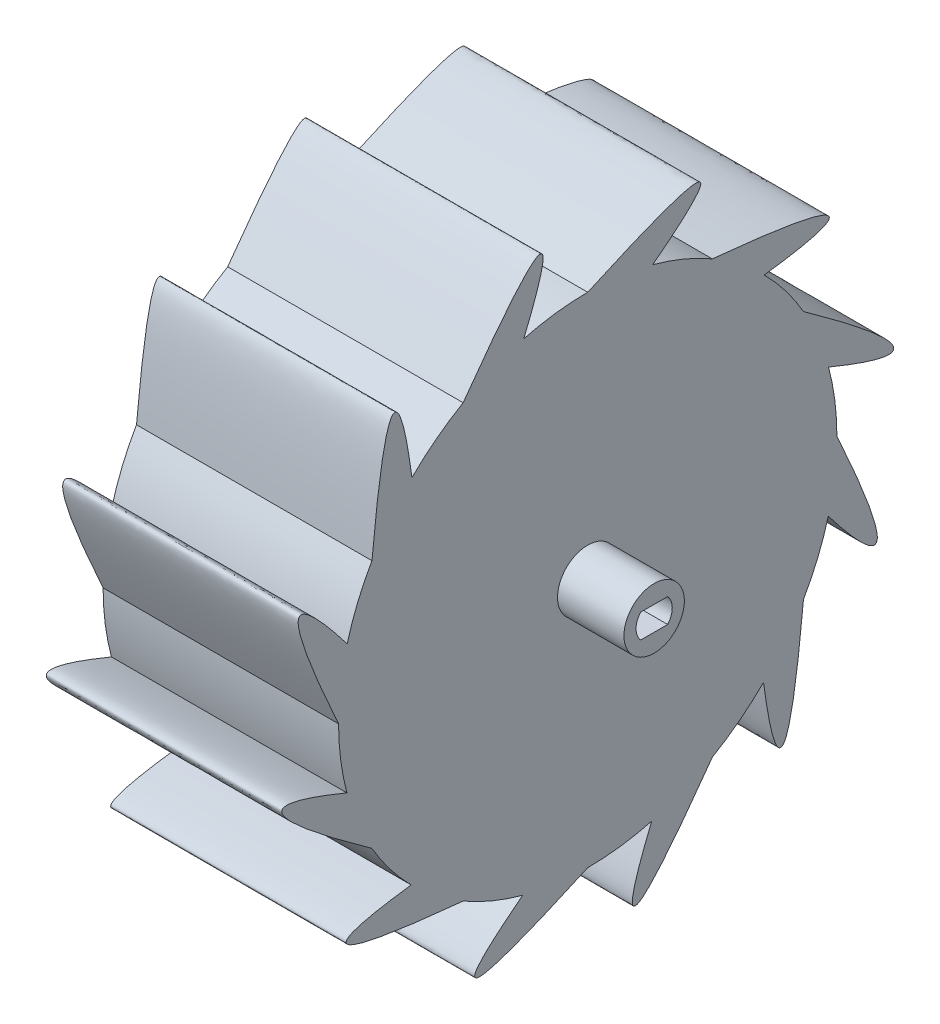
from build123d import *

# Parameters (mm, degrees)
SKETCH1_R           = 32.5
SKETCH1_R_2         = 5
BOSS_EXTRUDE1_DEPTH = 35
SKETCH2_R           = 8.5
SKETCH2_R_2         = 1
BOSS_EXTRUDE2_DEPTH = 1
SKETCH3_R           = 32.5
BOSS_EXTRUDE4_DEPTH = 2
SKETCH4_R           = 32.5
SKETCH4_R_2         = 5
BOSS_EXTRUDE5_DEPTH = 2
SKETCH5_R           = 5
BOSS_EXTRUDE6_DEPTH = 48
BOSS_EXTRUDE7_START = -39
SKETCH6_R           = 32.5
BOSS_EXTRUDE7_DEPTH = 39


with BuildPart() as part:
    # Sketch1 → Boss-Extrude1 (new body)
    with BuildSketch(Plane(origin=(0, 0, 0), x_dir=(0, 0, -1), z_dir=(1, 0, 0))):
        Circle(SKETCH1_R)
        Circle(SKETCH1_R_2, mode=Mode.SUBTRACT)
    extrude(amount=-BOSS_EXTRUDE1_DEPTH)



with BuildPart() as body_2:
    # Sketch2 → Boss-Extrude2 (new body)
    with BuildSketch(Plane.ZY.offset(35)):
        Circle(SKETCH2_R)
        Circle(SKETCH2_R_2, mode=Mode.SUBTRACT)
    extrude(amount=-BOSS_EXTRUDE2_DEPTH)


with BuildPart() as part_1:
    add(part.part)

    add(body_2.part)  # Boss-Extrude4 merges body 2
    # Sketch3 → Boss-Extrude4 (add)
    with BuildSketch(Plane.ZY.offset(35)):
        with Locations(Location((0, 0, 0), (0, 0, 180))):
            Circle(SKETCH3_R)
        with BuildLine():
            Line((12.893796958, 4), (20.615528128, 4))
            ThreePointArc((20.615528128, 4), (21, 0), (20.615528128, -4))
            Line((20.615528128, -4), (12.893796958, -4))
            ThreePointArc((12.893796958, -4), (13.5, 0), (12.893796958, 4))
        make_face(mode=Mode.SUBTRACT)
        with BuildLine():
            Line((7.788628447, -11.026661639), (10.174774605, -18.370464386))
            ThreePointArc((10.174774605, -18.370464386), (6.489356882, -19.972186842), (2.566322474, -20.842600341))
            Line((2.566322474, -20.842600341), (0.180176317, -13.498797594))
            ThreePointArc((0.180176317, -13.498797594), (4.171729424, -12.83926297), (7.788628447, -11.026661639))
        make_face(mode=Mode.SUBTRACT)
        with BuildLine():
            Line((-8.080159852, -10.814851676), (-14.327171594, -15.353571379))
            ThreePointArc((-14.327171594, -15.353571379), (-16.989356882, -12.343490298), (-19.029453613, -8.881435424))
            Line((-19.029453613, -8.881435424), (-12.78244187, -4.342715721))
            ThreePointArc((-12.78244187, -4.342715721), (-10.921729424, -7.935100906), (-8.080159852, -10.814851676))
        make_face(mode=Mode.SUBTRACT)
        with BuildLine():
            Line((-12.78244187, 4.342715721), (-19.029453613, 8.881435424))
            ThreePointArc((-19.029453613, 8.881435424), (-16.989356882, 12.343490298), (-14.327171594, 15.353571379))
            Line((-14.327171594, 15.353571379), (-8.080159852, 10.814851676))
            ThreePointArc((-8.080159852, 10.814851676), (-10.921729424, 7.935100906), (-12.78244187, 4.342715721))
        make_face(mode=Mode.SUBTRACT)
        with BuildLine():
            Line((0.180176317, 13.498797594), (2.566322474, 20.842600341))
            ThreePointArc((2.566322474, 20.842600341), (6.489356882, 19.972186842), (10.174774605, 18.370464386))
            Line((10.174774605, 18.370464386), (7.788628447, 11.026661639))
            ThreePointArc((7.788628447, 11.026661639), (4.171729424, 12.83926297), (0.180176317, 13.498797594))
        make_face(mode=Mode.SUBTRACT)
        with BuildLine():
            Line((-2.236067977, 2), (2.236067977, 2))
            ThreePointArc((2.236067977, 2), (3, 0), (2.236067977, -2))
            Line((2.236067977, -2), (-2.236067977, -2))
            ThreePointArc((-2.236067977, -2), (-3, 0), (-2.236067977, 2))
        make_face(mode=Mode.SUBTRACT)
    extrude(amount=BOSS_EXTRUDE4_DEPTH)

    # Sketch4 → Boss-Extrude5 (add)
    with BuildSketch(Plane.ZY.offset(37)):
        with Locations(Location((0, 0, 0), (0, 0, 180))):
            Circle(SKETCH4_R)
        with Locations(Location((0, 0, 0), (0, 0, 180))):
            Circle(SKETCH4_R_2, mode=Mode.SUBTRACT)
    extrude(amount=BOSS_EXTRUDE5_DEPTH)



with BuildPart() as body_2_2:
    # Sketch5 → Boss-Extrude6 (new body)
    with BuildSketch(Plane.ZY.offset(37)):
        with Locations(Location((0, 0, 0), (0, 0, 180))):
            Circle(SKETCH5_R)
        with BuildLine():
            Line((2.236067977, 2), (-2.236067977, 2))
            ThreePointArc((-2.236067977, 2), (-3, 0), (-2.236067977, -2))
            Line((-2.236067977, -2), (2.236067977, -2))
            ThreePointArc((2.236067977, -2), (3, 0), (2.236067977, 2))
        make_face(mode=Mode.SUBTRACT)
    extrude(amount=-BOSS_EXTRUDE6_DEPTH)


with BuildPart() as part_2:
    add(part_1.part)

    add(body_2_2.part)  # Boss-Extrude7 merges body 2 2
    # Sketch6 → Boss-Extrude7 (add)
    with BuildSketch(Plane.ZY.offset(39).offset(BOSS_EXTRUDE7_START)):
        with BuildLine():
            ThreePointArc((-29.245375884, 29.119081191), (-32.76885557, 25.088144702), (-35.740868414, 20.635))
            add(Edge.make_bspline(
                [(-35.740868414, 20.635), (-63.383686698, 0.881779004), (-39.886779054, 10.595176105)],
                knots=[0, 0, 0, 1, 1, 1], degree=2))
            ThreePointArc((-39.886779054, 10.595176105), (-40.922733728, 5.342542861), (-41.27, 0))
            add(Edge.make_bspline(
                [(-41.27, 0), (-55.332772368, -30.928200331), (-39.840551988, -10.767697863)],
                knots=[0, 0, 0, 1, 1, 1], degree=2))
            ThreePointArc((-39.840551988, -10.767697863), (-38.111398431, -15.834589026), (-35.740868414, -20.635))
            add(Edge.make_bspline(
                [(-35.740868414, -20.635), (-32.455486367, -54.450993364), (-29.119081191, -29.245375884)],
                knots=[0, 0, 0, 1, 1, 1], degree=2))
            ThreePointArc((-29.119081191, -29.245375884), (-25.088144702, -32.76885557), (-20.635, -35.740868414))
            add(Edge.make_bspline(
                [(-20.635, -35.740868414), (-0.881779004, -63.383686698), (-10.595176105, -39.886779054)],
                knots=[0, 0, 0, 1, 1, 1], degree=2))
            ThreePointArc((-10.595176105, -39.886779054), (-5.342542861, -40.922733728), (0, -41.27))
            add(Edge.make_bspline(
                [(0, -41.27), (30.928200331, -55.332772368), (10.767697863, -39.840551988)],
                knots=[0, 0, 0, 1, 1, 1], degree=2))
            ThreePointArc((10.767697863, -39.840551988), (15.834589026, -38.111398431), (20.635, -35.740868414))
            add(Edge.make_bspline(
                [(20.635, -35.740868414), (54.450993364, -32.455486367), (29.245375884, -29.119081191)],
                knots=[0, 0, 0, 1, 1, 1], degree=2))
            ThreePointArc((29.245375884, -29.119081191), (32.76885557, -25.088144702), (35.740868414, -20.635))
            add(Edge.make_bspline(
                [(35.740868414, -20.635), (63.383686698, -0.881779004), (39.886779054, -10.595176105)],
                knots=[0, 0, 0, 1, 1, 1], degree=2))
            ThreePointArc((39.886779054, -10.595176105), (40.922733728, -5.342542861), (41.27, 0))
            add(Edge.make_bspline(
                [(41.27, 0), (55.332772368, 30.928200331), (39.840551988, 10.767697863)],
                knots=[0, 0, 0, 1, 1, 1], degree=2))
            ThreePointArc((39.840551988, 10.767697863), (38.111398431, 15.834589026), (35.740868414, 20.635))
            add(Edge.make_bspline(
                [(35.740868414, 20.635), (32.455486367, 54.450993364), (29.119081191, 29.245375884)],
                knots=[0, 0, 0, 1, 1, 1], degree=2))
            ThreePointArc((29.119081191, 29.245375884), (25.088144702, 32.76885557), (20.635, 35.740868414))
            add(Edge.make_bspline(
                [(20.635, 35.740868414), (0.881779004, 63.383686698), (10.595176105, 39.886779054)],
                knots=[0, 0, 0, 1, 1, 1], degree=2))
            ThreePointArc((10.595176105, 39.886779054), (5.342542861, 40.922733728), (0, 41.27))
            add(Edge.make_bspline(
                [(0, 41.27), (-30.928200331, 55.332772368), (-10.767697863, 39.840551988)],
                knots=[0, 0, 0, 1, 1, 1], degree=2))
            ThreePointArc((-10.767697863, 39.840551988), (-15.834589026, 38.111398431), (-20.635, 35.740868414))
            add(Edge.make_bspline(
                [(-20.635, 35.740868414), (-54.450993364, 32.455486367), (-29.245375884, 29.119081191)],
                knots=[0, 0, 0, 1, 1, 1], degree=2))
        make_face()
        Circle(SKETCH6_R, mode=Mode.SUBTRACT)
    extrude(amount=BOSS_EXTRUDE7_DEPTH)


solid = part_2.part
